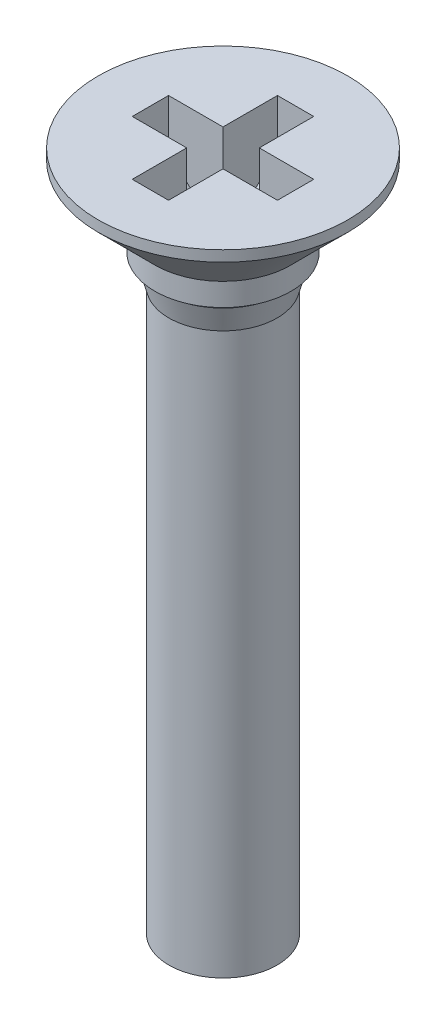
from build123d import *

# Parameters (mm, degrees)
KREUZSCHLITZ1_H_DEPTH      = 0.4
KREUZSCHLITZ1_H_DEPTH_BACK = 0.4
KREUZSCHLITZ2_H_DEPTH      = 0.4
KREUZSCHLITZ2_H_DEPTH_BACK = 0.4
BOSS_EXTRUDE1_START        = 7
SKETCH1_R                  = 1.1935
BOSS_EXTRUDE1_DEPTH        = 7


with BuildPart() as part:
    # Skizze1 → Basis-Rotation (revolve)
    with BuildSketch(Plane.XY, mode=Mode.PRIVATE) as basis_rotation_sk:
        Polygon((0, 0), (2.75, 0), (2.75, -0.2375), (1.5, -1.4875), (1.5, -1.9875), (1.3375, -1.9875), (1.3375, -2.112584684), (1.1935, -2.65), (1.1935, -8), (0, -8), align=None)
    revolve(basis_rotation_sk.sketch.rotate(Axis((0, 0, 0), (0, -1, 0)), 180), axis=Axis((0, 0, 0), (0, -1, 0)))

    # Skizze2 → Kreuzschlitz1 H (cut, two sides: drawn at the far end of the back side and taken through both)
    with BuildSketch(Plane.XY.offset(-KREUZSCHLITZ1_H_DEPTH_BACK)):
        Polygon((-0.55, -2.1), (0.55, -2.1), (1.6, -1.05), (1.6, 0), (-1.6, 0), (-1.6, -1.05), align=None)
    extrude(amount=KREUZSCHLITZ1_H_DEPTH + KREUZSCHLITZ1_H_DEPTH_BACK, mode=Mode.SUBTRACT)

    # Skizze3 → Kreuzschlitz2 H (cut, two sides: drawn at the far end of the back side and taken through both)
    with BuildSketch(Plane(origin=(0, 0, 0), x_dir=(0, 0, -1), z_dir=(1, 0, 0)).offset(-KREUZSCHLITZ2_H_DEPTH_BACK)):
        Polygon((-0.55, -2.1), (0.55, -2.1), (1.6, -1.05), (1.6, 0), (-1.6, 0), (-1.6, -1.05), align=None)
    extrude(amount=KREUZSCHLITZ2_H_DEPTH + KREUZSCHLITZ2_H_DEPTH_BACK, mode=Mode.SUBTRACT)

    # Sketch1 → Boss-Extrude1 (add)
    with BuildSketch(Plane.XZ.offset(8).offset(BOSS_EXTRUDE1_START)):
        with Locations(Location((0, 0, 0), (0, 0, 180))):
            Circle(SKETCH1_R)
    extrude(amount=-BOSS_EXTRUDE1_DEPTH)


solid = part.part
